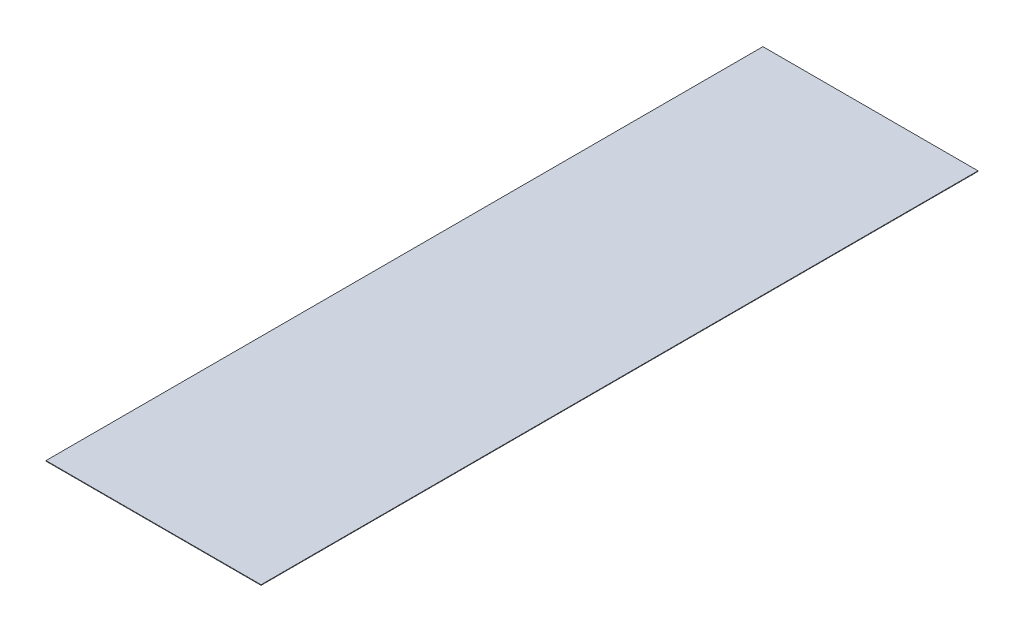
from build123d import *

# Parameters (mm, degrees)
CROQUIS1_W              = 914.4
CROQUIS1_H              = 3048
SALIENTE_EXTRUIR1_DEPTH = 2.3


with BuildPart() as part:
    # Croquis1 → Saliente-Extruir1 (new body)
    with BuildSketch(Plane(origin=(0, 0, 0), x_dir=(1, 0, 0), z_dir=(0, 1, 0))):
        Rectangle(CROQUIS1_W, CROQUIS1_H)
    extrude(amount=SALIENTE_EXTRUIR1_DEPTH)


solid = part.part
